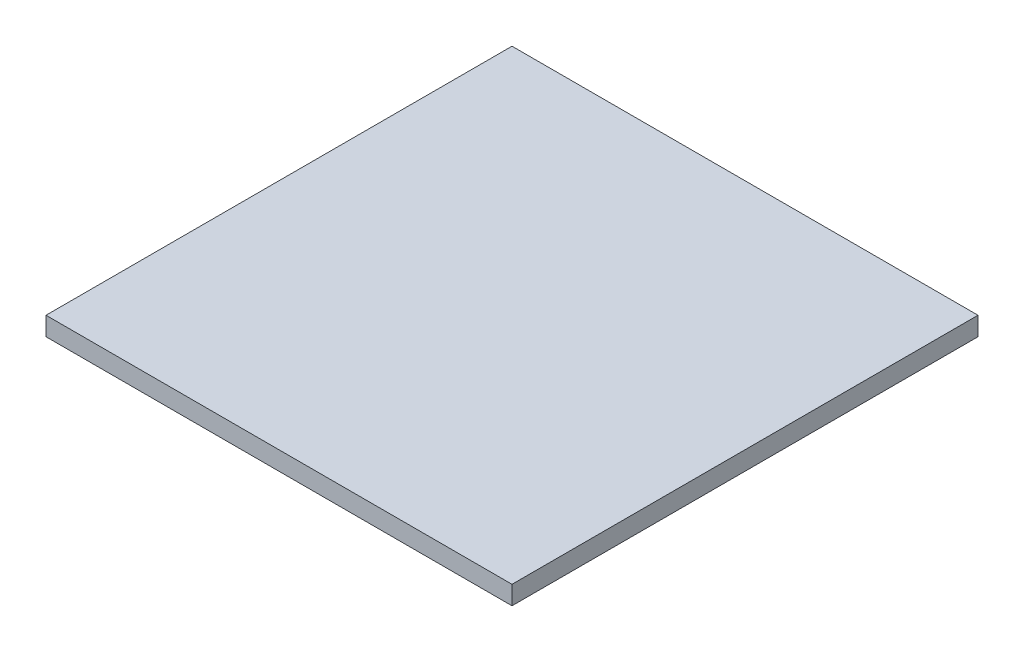
from build123d import *

# Parameters (mm, degrees)
SKETCH6_W           = 50
SKETCH6_H           = 50
BOSS_EXTRUDE1_DEPTH = 2


with BuildPart() as part:
    # Sketch6 → Boss-Extrude1 (new body)
    with BuildSketch(Plane(origin=(0, 0, 0), x_dir=(1, 0, 0), z_dir=(0, 1, 0))):
        with Locations((25, 25)):
            Rectangle(SKETCH6_W, SKETCH6_H)
    extrude(amount=BOSS_EXTRUDE1_DEPTH)


solid = part.part
